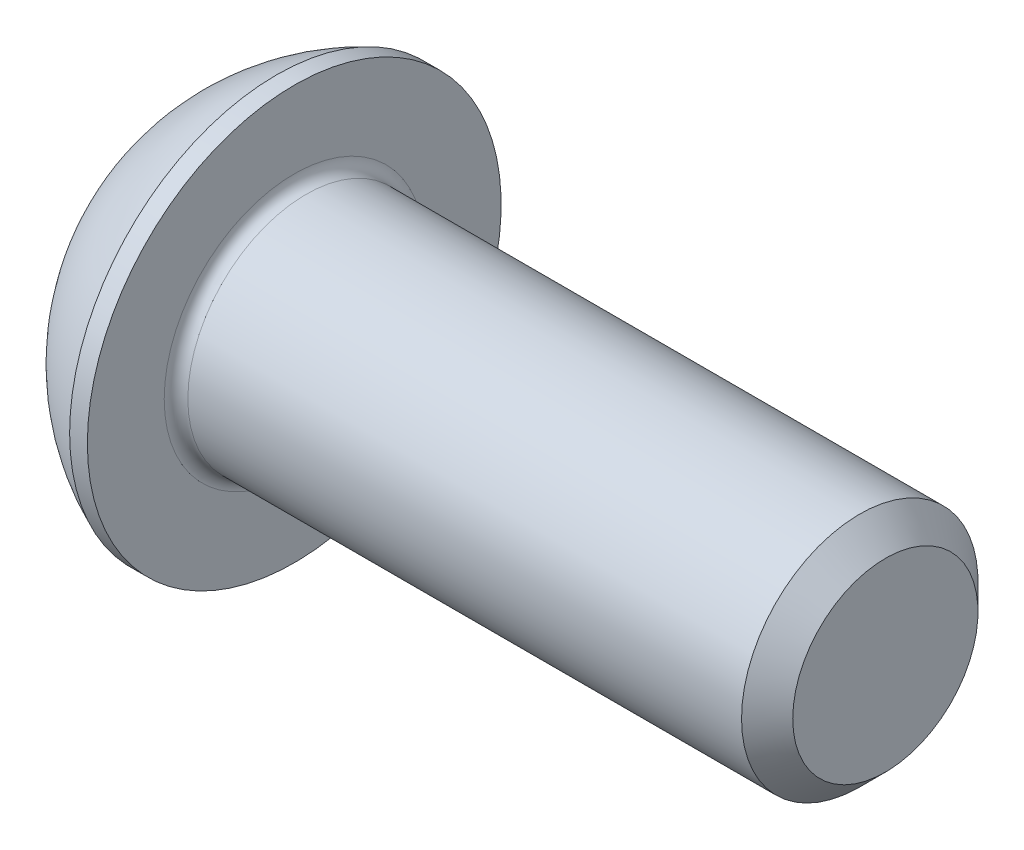
from build123d import *

# Parameters (mm, degrees)
FILLET1_R   = 0.1
HEX_2_DEPTH = 0.605


with BuildPart() as part:
    # BodySke → BaseBody (revolve)
    with BuildSketch(Plane.XY, mode=Mode.PRIVATE) as basebody_sk:
        with BuildLine():
            Line((6.1, 0), (6.1, 0.7835))
            Line((6.1, 0.7835), (5.8835, 1))
            Line((5.8835, 1), (1.1, 1))
            Line((1.1, 1), (1.1, 1.75))
            Line((1.1, 1.75), (0.95, 1.75))
            ThreePointArc((0.95, 1.75), (0.398268526, 1.395808457), (0, 0.875))
            Line((0, 0.875), (0, 0))
            Line((0, 0), (6.1, 0))
        make_face()
    revolve(basebody_sk.sketch.rotate(Axis((0, 0, 0), (1, 0, 0)), 90), axis=Axis((0, 0, 0), (1, 0, 0)))

    # Fillet1
    fillet1_edges = [part.edges().sort_by_distance(p)[0] for p in [
        (1.1, 0, -1),
    ]]
    fillet(fillet1_edges, radius=FILLET1_R)

    # Sketch2 → PreBroach (revolve, cut)
    with BuildSketch(Plane.XY, mode=Mode.PRIVATE) as prebroach_sk:
        Polygon((0, 0.715), (0.605, 0.715), (1.017805442, 0), (0, 0), align=None)
    revolve(prebroach_sk.sketch.rotate(Axis((0, 0, 0), (1, 0, 0)), 90), axis=Axis((0, 0, 0), (1, 0, 0)), mode=Mode.SUBTRACT)

    # Sketch3 → Hex 2 (cut)
    with BuildSketch(Plane(origin=(0, 0, 0), x_dir=(0, 0, -1), z_dir=(1, 0, 0))):
        Polygon((-0.65, -0.375277675), (-0.65, 0.375277675), (0, 0.75055535), (0.65, 0.375277675), (0.65, -0.375277675), (0, -0.75055535), align=None)
    extrude(amount=HEX_2_DEPTH, mode=Mode.SUBTRACT)


solid = part.part
